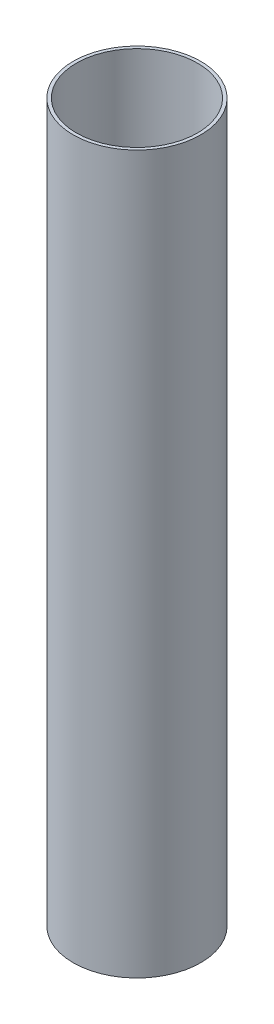
from build123d import *

# Parameters (mm, degrees)
SKETCH1_R           = 32.9
SKETCH1_R_2         = 31.25
BOSS_EXTRUDE1_DEPTH = 185


with BuildPart() as part:
    # Sketch1 → Boss-Extrude1 (new, symmetric)
    with BuildSketch(Plane(origin=(0, 0, 0), x_dir=(1, 0, 0), z_dir=(0, 1, 0))):
        with Locations(Location((0, 0, 0), (0, 0, 270))):
            Circle(SKETCH1_R)
        with Locations(Location((0, 0, 0), (0, 0, 270))):
            Circle(SKETCH1_R_2, mode=Mode.SUBTRACT)
    extrude(amount=BOSS_EXTRUDE1_DEPTH, both=True)


solid = part.part
